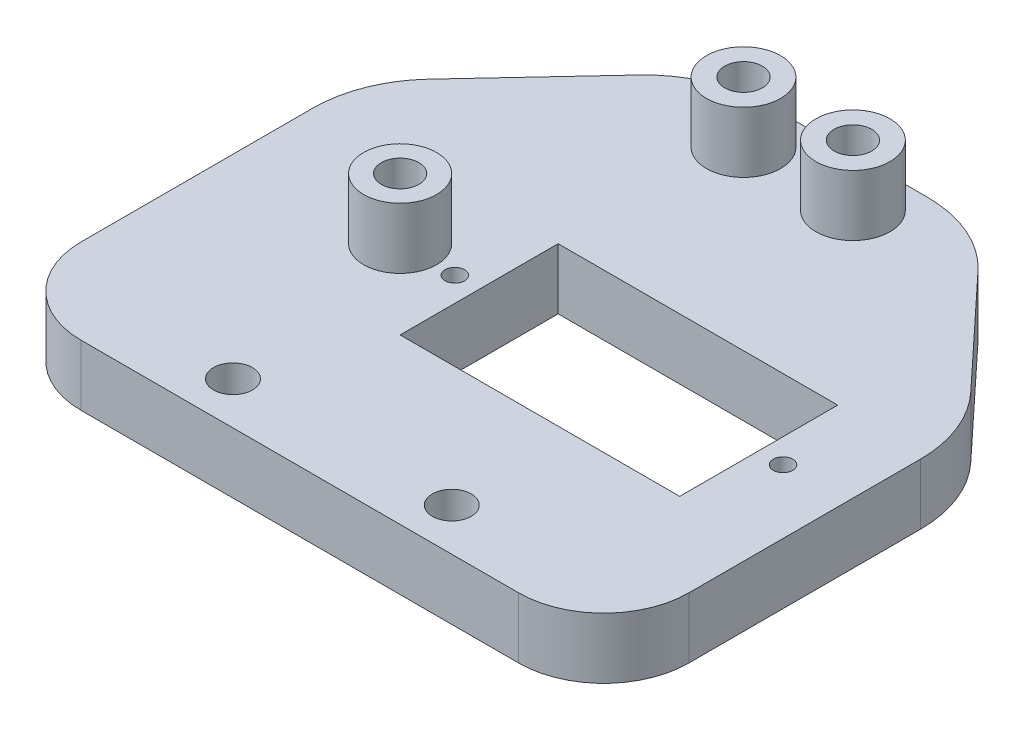
from build123d import *

# Parameters (mm, degrees)
SKETCH_1_R          = 1.55
EXTRUDE_1_DEPTH     = 5
SKETCH_2_R          = 1.55
CUT_EXTRUDE_1_DEPTH = 5
FILLET_1_R          = 10
SKETCH_4_R          = 0.8
SKETCH_4_W          = 23
SKETCH_4_H          = 13
SKETCH_4_R_2        = 1.55
CUT_EXTRUDE_2_DEPTH = 5
EXTRUDE_START       = 5
SKETCH_5_R          = 3.05
SKETCH_5_R_2        = 1.55
SKETCH_5_R_3        = 3
EXTRUDE_2_DEPTH     = 5
SKETCH_8_R          = 1.55
CUT_EXTRUDE_4_DEPTH = 11
SKETCH_6_R          = 1.6
CUT_EXTRUDE_6_DEPTH = 10
CHAMFER_1_SIZE      = 0.3
FILLET_2_R          = 7


with BuildPart() as part:
    # 草图1 → 凸台-拉伸1 (new body)
    with BuildSketch(Plane(origin=(0, 0, 0), x_dir=(1, 0, 0), z_dir=(0, 1, 0))):
        Polygon((-11, 30), (-25, 15), (-25, -15), (25, -15), (25, 15), (11, 30), align=None)
        with Locations(Location((-11.75, 5, 0), (0, 0, 270))):
            Circle(SKETCH_1_R, mode=Mode.SUBTRACT)
        with Locations(Location((11.75, 5, 0), (0, 0, 90))):
            Circle(SKETCH_1_R, mode=Mode.SUBTRACT)
    extrude(amount=EXTRUDE_1_DEPTH)

    # 草图2 → 切除-拉伸1 (cut)
    with BuildSketch(Plane(origin=(0, 5, 0), x_dir=(1, 0, 0), z_dir=(0, 1, 0))):
        with Locations(Location((-4.5, 26, 0), (0, 0, 270))):
            Circle(SKETCH_2_R)
        with Locations(Location((4.5, 26, 0), (0, 0, 90))):
            Circle(SKETCH_2_R)
    extrude(amount=-CUT_EXTRUDE_1_DEPTH, mode=Mode.SUBTRACT)

    # 圆角1
    fillet_1_edges = [part.edges().sort_by_distance(p)[0] for p in [
        (-25, 2.5, -15),
        (-11, 2.5, -30),
        (11, 2.5, -30),
        (25, 2.5, -15),
    ]]
    fillet(fillet_1_edges, radius=FILLET_1_R)

    # 草图4 → 切除-拉伸2 (cut)
    # profile 1 of 3: a face of its own
    with BuildSketch(Plane.XZ):
        with Locations(Location((19.75, -5, 0), (0, 0, 270))):
            Circle(SKETCH_4_R)
    # profile 2 of 3: a face of its own
    with BuildSketch(Plane.XZ):
        with Locations(Location((-7.25, -5, 0), (0, 0, 90))):
            Circle(SKETCH_4_R)
    # profile 3 of 3: a face of its own
    with BuildSketch(Plane.XZ):
        with Locations((6.25, -5)):
            Rectangle(SKETCH_4_W, SKETCH_4_H)
        with Locations((11.75, -5)):
            Circle(SKETCH_4_R_2, mode=Mode.SUBTRACT)
    extrude(amount=-CUT_EXTRUDE_2_DEPTH, mode=Mode.SUBTRACT)

    # 草图5 → 凸台-拉伸2 (add)
    # profile 1 of 3: a face of its own
    with BuildSketch(Plane(origin=(0, 5, 0), x_dir=(1, 0, 0), z_dir=(0, 1, 0)).offset(EXTRUDE_START)):
        with Locations(Location((-4.5, 26, 0), (0, 0, 270))):
            Circle(SKETCH_5_R)
        with Locations(Location((-4.5, 26, 0), (0, 0, 270))):
            Circle(SKETCH_5_R_2, mode=Mode.SUBTRACT)
    # profile 2 of 3: a face of its own
    with BuildSketch(Plane(origin=(0, 5, 0), x_dir=(1, 0, 0), z_dir=(0, 1, 0)).offset(EXTRUDE_START)):
        with Locations(Location((4.5, 26, 0), (0, 0, 270))):
            Circle(SKETCH_5_R)
        with Locations(Location((4.5, 26, 0), (0, 0, 270))):
            Circle(SKETCH_5_R_2, mode=Mode.SUBTRACT)
    # profile 3 of 3: a face of its own
    with BuildSketch(Plane(origin=(0, 5, 0), x_dir=(1, 0, 0), z_dir=(0, 1, 0)).offset(EXTRUDE_START)):
        with Locations(Location((-11.75, 5, 0), (0, 0, 270))):
            Circle(SKETCH_5_R_3)
    extrude(amount=-EXTRUDE_2_DEPTH)

    # 草图8 → 切除-拉伸4 (cut)
    with BuildSketch(Plane.XZ):
        with Locations(Location((-11.75, -5, 0), (0, 0, 90))):
            Circle(SKETCH_8_R)
    extrude(amount=-CUT_EXTRUDE_4_DEPTH, mode=Mode.SUBTRACT)

    # 草图6 → 切除-拉伸6 (cut)
    with BuildSketch(Plane(origin=(0, 5, 0), x_dir=(1, 0, 0), z_dir=(0, 1, 0))):
        with Locations(Location((-9, -11.5, 0), (0, 0, 270))):
            Circle(SKETCH_6_R)
        with Locations(Location((9, -11.5, 0), (0, 0, 270))):
            Circle(SKETCH_6_R)
    extrude(amount=-CUT_EXTRUDE_6_DEPTH, mode=Mode.SUBTRACT)

    # 倒角1
    chamfer_1_edges = [part.edges().sort_by_distance(p)[0] for p in [
        (-9, 0, 9.9),
        (9, 0, 9.9),
    ]]
    chamfer(chamfer_1_edges, length=CHAMFER_1_SIZE)

    # 圆角2
    fillet_2_edges = [part.edges().sort_by_distance(p)[0] for p in [
        (25, 2.5, 15),
        (-25, 2.5, 15),
    ]]
    fillet(fillet_2_edges, radius=FILLET_2_R)


solid = part.part
